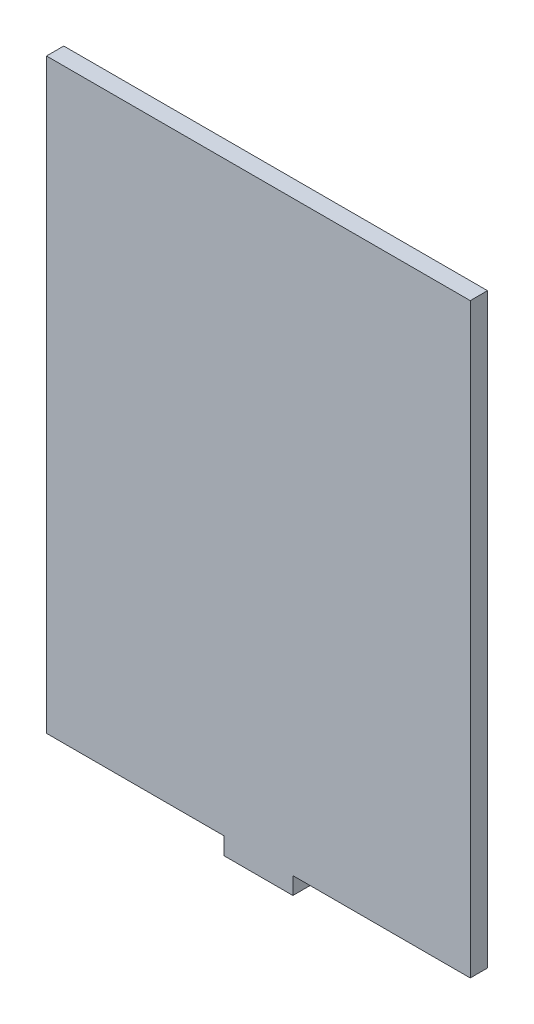
from build123d import *

# Parameters (mm, degrees)
BOSS_EXTRUDE1_DEPTH = 5


with BuildPart() as part:
    # Sketch1 → Boss-Extrude1 (new body)
    with BuildSketch(Plane.XY):
        Polygon((-61.4, -85), (-10, -85), (-10, -90), (10, -90), (10, -85), (61.4, -85), (61.4, 85), (-61.4, 85), align=None)
    extrude(amount=BOSS_EXTRUDE1_DEPTH)


solid = part.part
